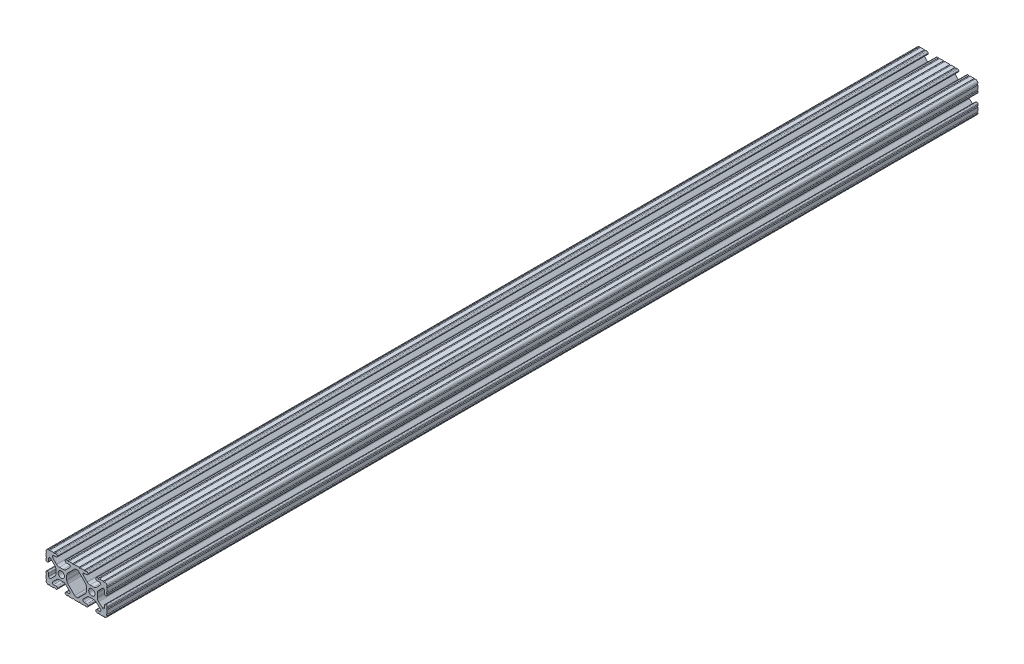
from build123d import *

# Parameters (mm, degrees)
SKETCH1_R           = 2.6035
BOSS_EXTRUDE1_DEPTH = 361.95


with BuildPart() as part:
    # Sketch1 → Boss-Extrude1 (new, symmetric)
    with BuildSketch(Plane.XY):
        with BuildLine():
            Line((18.01710265, 12.7), (16.98745015, 12.7))
            ThreePointArc((16.98745015, 12.7), (16.245730386, 12.392769614), (15.9385, 11.65104985))
            Line((15.9385, 11.65104985), (15.9385, 11.53922))
            ThreePointArc((15.9385, 11.53922), (16.245750844, 10.797450844), (16.98752, 10.4902))
            Line((16.98752, 10.4902), (19.116384363, 10.4902))
            ThreePointArc((19.116384363, 10.4902), (20.052502933, 9.869096983), (19.844087081, 8.765172272))
            Line((19.844087081, 8.765172272), (16.618993479, 5.455112286))
            ThreePointArc((16.618993479, 5.455112286), (15.578994274, 4.745442459), (14.344932584, 4.4958))
            Line((14.344932584, 4.4958), (11.083317835, 4.4958))
            ThreePointArc((11.083317835, 4.4958), (9.854330953, 4.743306833), (8.816955189, 5.447238587))
            Line((8.816955189, 5.447238587), (5.564154119, 8.762652677))
            ThreePointArc((5.564154119, 8.762652677), (5.352591412, 9.867473037), (6.289393385, 10.4902))
            Line((6.289393385, 10.4902), (8.41248, 10.4902))
            ThreePointArc((8.41248, 10.4902), (9.154249156, 10.797450844), (9.4615, 11.53922))
            Line((9.4615, 11.53922), (9.4615, 11.65104985))
            ThreePointArc((9.4615, 11.65104985), (9.154269614, 12.392769614), (8.41254985, 12.7))
            Line((8.41254985, 12.7), (7.38288465, 12.7))
            ThreePointArc((7.38288465, 12.7), (6.87488465, 12.192), (6.36688465, 12.7))
            Line((6.36688465, 12.7), (3.14958095, 12.7))
            ThreePointArc((3.14958095, 12.7), (2.64158095, 12.192), (2.13358095, 12.7))
            Line((2.13358095, 12.7), (-2.13358095, 12.7))
            ThreePointArc((-2.13358095, 12.7), (-2.64158095, 12.192), (-3.14958095, 12.7))
            Line((-3.14958095, 12.7), (-6.36689735, 12.7))
            ThreePointArc((-6.36689735, 12.7), (-6.87489735, 12.192), (-7.38289735, 12.7))
            Line((-7.38289735, 12.7), (-8.41254985, 12.7))
            ThreePointArc((-8.41254985, 12.7), (-9.154269614, 12.392769614), (-9.4615, 11.65104985))
            Line((-9.4615, 11.65104985), (-9.4615, 11.53922))
            ThreePointArc((-9.4615, 11.53922), (-9.154249156, 10.797450844), (-8.41248, 10.4902))
            Line((-8.41248, 10.4902), (-6.283641037, 10.4902))
            ThreePointArc((-6.283641037, 10.4902), (-5.297291557, 9.829633109), (-5.532576693, 8.666071843))
            Line((-5.532576693, 8.666071843), (-8.809985098, 5.416263103))
            ThreePointArc((-8.809985098, 5.416263103), (-9.836720513, 4.734920264), (-11.045536121, 4.4958))
            Line((-11.045536121, 4.4958), (-14.354463879, 4.4958))
            ThreePointArc((-14.354463879, 4.4958), (-15.563279487, 4.734920264), (-16.590014902, 5.416263103))
            Line((-16.590014902, 5.416263103), (-19.867423307, 8.666071843))
            ThreePointArc((-19.867423307, 8.666071843), (-20.102708443, 9.829633109), (-19.116358963, 10.4902))
            Line((-19.116358963, 10.4902), (-16.98752, 10.4902))
            ThreePointArc((-16.98752, 10.4902), (-16.245750844, 10.797450844), (-15.9385, 11.53922))
            Line((-15.9385, 11.53922), (-15.9385, 11.65104985))
            ThreePointArc((-15.9385, 11.65104985), (-16.245730386, 12.392769614), (-16.98745015, 12.7))
            Line((-16.98745015, 12.7), (-18.01711535, 12.7))
            ThreePointArc((-18.01711535, 12.7), (-18.52511535, 12.192), (-19.03311535, 12.7))
            Line((-19.03311535, 12.7), (-22.2504, 12.7))
            ThreePointArc((-22.2504, 12.7), (-22.758323491, 12.192000006), (-23.266399977, 12.699846982))
            ThreePointArc((-23.266399977, 12.699846982), (-24.782522516, 12.082522516), (-25.399846982, 10.566399977))
            ThreePointArc((-25.399846982, 10.566399977), (-24.892000006, 10.058323491), (-25.4, 9.5504))
            Line((-25.4, 9.5504), (-25.4, 6.3330836))
            ThreePointArc((-25.4, 6.3330836), (-24.892, 5.8250836), (-25.4, 5.3170836))
            Line((-25.4, 5.3170836), (-25.4, 4.237520184))
            ThreePointArc((-25.4, 4.237520184), (-25.107393763, 3.531106237), (-24.400979816, 3.2385))
            Line((-24.400979816, 3.2385), (-24.23922, 3.2385))
            ThreePointArc((-24.23922, 3.2385), (-23.497450844, 3.545750844), (-23.1902, 4.28752))
            Line((-23.1902, 4.28752), (-23.1902, 6.334741132))
            ThreePointArc((-23.1902, 6.334741132), (-22.556026952, 7.286023527), (-21.434002553, 7.066535717))
            Line((-21.434002553, 7.066535717), (-18.147950853, 3.808156468))
            ThreePointArc((-18.147950853, 3.808156468), (-17.452759693, 2.774838327), (-17.208501877, 1.553619571))
            Line((-17.208501877, 1.553619571), (-17.208501877, -1.695179196))
            ThreePointArc((-17.208501877, -1.695179196), (-17.450738657, -2.911536421), (-18.140486065, -3.942289578))
            Line((-18.140486065, -3.942289578), (-21.431579576, -7.227386226))
            ThreePointArc((-21.431579576, -7.227386226), (-22.55444896, -7.449940594), (-23.1902, -6.498002195))
            Line((-23.1902, -6.498002195), (-23.1902, -4.28752))
            ThreePointArc((-23.1902, -4.28752), (-23.497450844, -3.545750844), (-24.23922, -3.2385))
            Line((-24.23922, -3.2385), (-24.35098, -3.2385))
            ThreePointArc((-24.35098, -3.2385), (-25.092749156, -3.545750844), (-25.4, -4.28752))
            Line((-25.4, -4.28752), (-25.4, -5.3171344))
            ThreePointArc((-25.4, -5.3171344), (-24.892, -5.8251344), (-25.4, -6.3331344))
            Line((-25.4, -6.3331344), (-25.4, -9.5504))
            ThreePointArc((-25.4, -9.5504), (-24.892000006, -10.058323491), (-25.399846982, -10.566399977))
            ThreePointArc((-25.399846982, -10.566399977), (-24.782522516, -12.082522516), (-23.266399977, -12.699846982))
            ThreePointArc((-23.266399977, -12.699846982), (-22.758323491, -12.192000006), (-22.2504, -12.7))
            Line((-22.2504, -12.7), (-19.03308995, -12.7))
            ThreePointArc((-19.03308995, -12.7), (-18.52508995, -12.192), (-18.01708995, -12.7))
            Line((-18.01708995, -12.7), (-16.9874692, -12.7))
            ThreePointArc((-16.9874692, -12.7), (-16.245700044, -12.392749156), (-15.9384492, -11.65098))
            Line((-15.9384492, -11.65098), (-15.9384492, -11.53922))
            ThreePointArc((-15.9384492, -11.53922), (-16.245700044, -10.797450844), (-16.9874692, -10.4902))
            Line((-16.9874692, -10.4902), (-19.116358963, -10.4902))
            ThreePointArc((-19.116358963, -10.4902), (-20.055197748, -9.862578342), (-19.834124023, -8.755124678))
            Line((-19.834124023, -8.755124678), (-16.49660751, -5.423689618))
            ThreePointArc((-16.49660751, -5.423689618), (-15.467274017, -4.736928798), (-14.253591699, -4.4958))
            Line((-14.253591699, -4.4958), (-11.146408301, -4.4958))
            ThreePointArc((-11.146408301, -4.4958), (-9.932725983, -4.736928798), (-8.90339249, -5.423689618))
            Line((-8.90339249, -5.423689618), (-5.565875977, -8.755124678))
            ThreePointArc((-5.565875977, -8.755124678), (-5.344802252, -9.862578342), (-6.283641037, -10.4902))
            Line((-6.283641037, -10.4902), (-8.4125308, -10.4902))
            ThreePointArc((-8.4125308, -10.4902), (-9.154299956, -10.797450844), (-9.4615508, -11.53922))
            Line((-9.4615508, -11.53922), (-9.4615508, -11.65098))
            ThreePointArc((-9.4615508, -11.65098), (-9.154299956, -12.392749156), (-8.4125308, -12.7))
            Line((-8.4125308, -12.7), (-7.38287195, -12.7))
            ThreePointArc((-7.38287195, -12.7), (-6.87487195, -12.192), (-6.36687195, -12.7))
            Line((-6.36687195, -12.7), (-3.14960635, -12.7))
            ThreePointArc((-3.14960635, -12.7), (-2.64160635, -12.192), (-2.13360635, -12.7))
            Line((-2.13360635, -12.7), (2.13360635, -12.7))
            ThreePointArc((2.13360635, -12.7), (2.64159365, -12.1920127), (3.14958095, -12.7))
            Line((3.14958095, -12.7), (6.36691005, -12.7))
            ThreePointArc((6.36691005, -12.7), (6.87491005, -12.192), (7.38291005, -12.7))
            Line((7.38291005, -12.7), (8.4125308, -12.7))
            ThreePointArc((8.4125308, -12.7), (9.154299956, -12.392749156), (9.4615508, -11.65098))
            Line((9.4615508, -11.65098), (9.4615508, -11.53922))
            ThreePointArc((9.4615508, -11.53922), (9.154299956, -10.797450844), (8.4125308, -10.4902))
            Line((8.4125308, -10.4902), (6.289393385, -10.4902))
            ThreePointArc((6.289393385, -10.4902), (5.231590322, -9.783049717), (5.480677245, -8.535265862))
            Line((5.480677245, -8.535265862), (8.597933595, -5.423689618))
            ThreePointArc((8.597933595, -5.423689618), (9.627267088, -4.736928798), (10.840949406, -4.4958))
            Line((10.840949406, -4.4958), (14.102564155, -4.4958))
            ThreePointArc((14.102564155, -4.4958), (15.215927525, -4.697410182), (16.187895372, -5.276636531))
            Line((16.187895372, -5.276636531), (19.868247549, -8.482246082))
            ThreePointArc((19.868247549, -8.482246082), (20.188435806, -9.746879864), (19.116384363, -10.4902))
            Line((19.116384363, -10.4902), (16.9874692, -10.4902))
            ThreePointArc((16.9874692, -10.4902), (16.245700044, -10.797450844), (15.9384492, -11.53922))
            Line((15.9384492, -11.53922), (15.9384492, -11.65098))
            ThreePointArc((15.9384492, -11.65098), (16.245700044, -12.392749156), (16.9874692, -12.7))
            Line((16.9874692, -12.7), (18.01710265, -12.7))
            ThreePointArc((18.01710265, -12.7), (18.52510265, -12.192), (19.03310265, -12.7))
            Line((19.03310265, -12.7), (22.2504, -12.7))
            ThreePointArc((22.2504, -12.7), (22.758323491, -12.192000006), (23.266399977, -12.699846982))
            ThreePointArc((23.266399977, -12.699846982), (24.782522516, -12.082522516), (25.399846982, -10.566399977))
            ThreePointArc((25.399846982, -10.566399977), (24.892000006, -10.058323492), (25.4, -9.550400001))
            Line((25.4, -9.550400001), (25.4, -6.333083592))
            ThreePointArc((25.4, -6.333083592), (24.892000001, -5.825083593), (25.4, -5.317083593))
            Line((25.4, -5.317083593), (25.4, -4.237520184))
            ThreePointArc((25.4, -4.237520184), (25.107393763, -3.531106237), (24.400979816, -3.2385))
            Line((24.400979816, -3.2385), (24.189220184, -3.2385))
            ThreePointArc((24.189220184, -3.2385), (23.482806237, -3.531106237), (23.1902, -4.237520184))
            Line((23.1902, -4.237520184), (23.1902, -6.155876159))
            ThreePointArc((23.1902, -6.155876159), (22.62232736, -7.038258539), (21.583974541, -6.886926384))
            Line((21.583974541, -6.886926384), (18.29817066, -4.024970844))
            ThreePointArc((18.29817066, -4.024970844), (17.493730985, -2.946044689), (17.208501877, -1.630807374))
            Line((17.208501877, -1.630807374), (17.208501877, 1.630807374))
            ThreePointArc((17.208501877, 1.630807374), (17.442348332, 2.82673414), (18.109440981, 3.846495088))
            Line((18.109440981, 3.846495088), (21.526346532, 7.353420386))
            ThreePointArc((21.526346532, 7.353420386), (22.585896263, 7.574939077), (23.1902, 6.676867167))
            Line((23.1902, 6.676867167), (23.1902, 4.237520184))
            ThreePointArc((23.1902, 4.237520184), (23.482806237, 3.531106237), (24.189220184, 3.2385))
            Line((24.189220184, 3.2385), (24.400979816, 3.2385))
            ThreePointArc((24.400979816, 3.2385), (25.107393763, 3.531106237), (25.4, 4.237520184))
            Line((25.4, 4.237520184), (25.4, 5.3170836))
            ThreePointArc((25.4, 5.3170836), (24.891949193, 5.825134407), (25.4, 6.333185215))
            Line((25.4, 6.333185215), (25.4, 9.550400015))
            ThreePointArc((25.4, 9.550400015), (24.892000013, 10.058323498), (25.399846982, 10.566399977))
            ThreePointArc((25.399846982, 10.566399977), (24.782522516, 12.082522516), (23.266399977, 12.699846982))
            ThreePointArc((23.266399977, 12.699846982), (22.758323491, 12.192000006), (22.2504, 12.7))
            Line((22.2504, 12.7), (19.03310265, 12.7))
            ThreePointArc((19.03310265, 12.7), (18.52510265, 12.192), (18.01710265, 12.7))
        make_face()
        with Locations((-12.7, 0)):
            Circle(SKETCH1_R, mode=Mode.SUBTRACT)
        with Locations((12.7, 0)):
            Circle(SKETCH1_R, mode=Mode.SUBTRACT)
        with BuildLine():
            Line((-7.259513935, -3.869413038), (-1.545748891, -9.572766749))
            ThreePointArc((-1.545748891, -9.572766749), (-1.035199478, -9.913400116), (-0.433213048, -10.033))
            Line((-0.433213048, -10.033), (0.433213048, -10.033))
            ThreePointArc((0.433213048, -10.033), (1.035199478, -9.913400116), (1.545748891, -9.572766749))
            Line((1.545748891, -9.572766749), (7.259513935, -3.869413038))
            ThreePointArc((7.259513935, -3.869413038), (7.949261343, -2.838659881), (8.191498123, -1.622302656))
            Line((8.191498123, -1.622302656), (8.191498123, 1.622302656))
            ThreePointArc((8.191498123, 1.622302656), (7.955573352, 2.823327967), (7.282860769, 3.845864069))
            Line((7.282860769, 3.845864069), (1.675572808, 9.561086461))
            ThreePointArc((1.675572808, 9.561086461), (1.161034429, 9.910236611), (0.551456936, 10.033))
            Line((0.551456936, 10.033), (-0.395199982, 10.033))
            ThreePointArc((-0.395199982, 10.033), (-0.994772524, 9.914396349), (-1.50403329, 9.576450301))
            Line((-1.50403329, 9.576450301), (-7.252049147, 3.876839553))
            ThreePointArc((-7.252049147, 3.876839553), (-7.947240307, 2.843521412), (-8.191498123, 1.622302656))
            Line((-8.191498123, 1.622302656), (-8.191498123, -1.622302656))
            ThreePointArc((-8.191498123, -1.622302656), (-7.949261343, -2.838659881), (-7.259513935, -3.869413038))
        make_face(mode=Mode.SUBTRACT)
    extrude(amount=BOSS_EXTRUDE1_DEPTH, both=True)


solid = part.part
